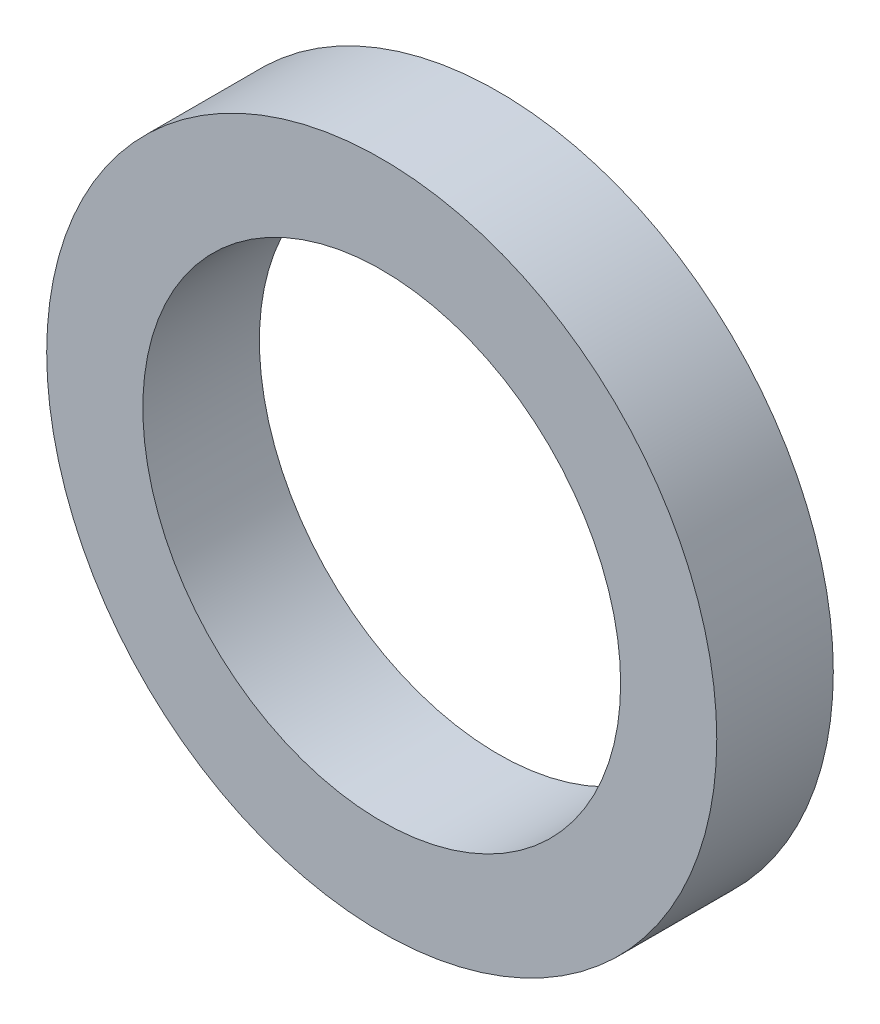
from build123d import *

# Parameters (mm, degrees)
SKETCH1_R    = 5.75
SKETCH1_R_2  = 4.1
SPACER_DEPTH = 2


with BuildPart() as part:
    # Sketch1 → Spacer (new body)
    with BuildSketch(Plane.XY):
        Circle(SKETCH1_R)
        Circle(SKETCH1_R_2, mode=Mode.SUBTRACT)
    extrude(amount=SPACER_DEPTH)


solid = part.part
